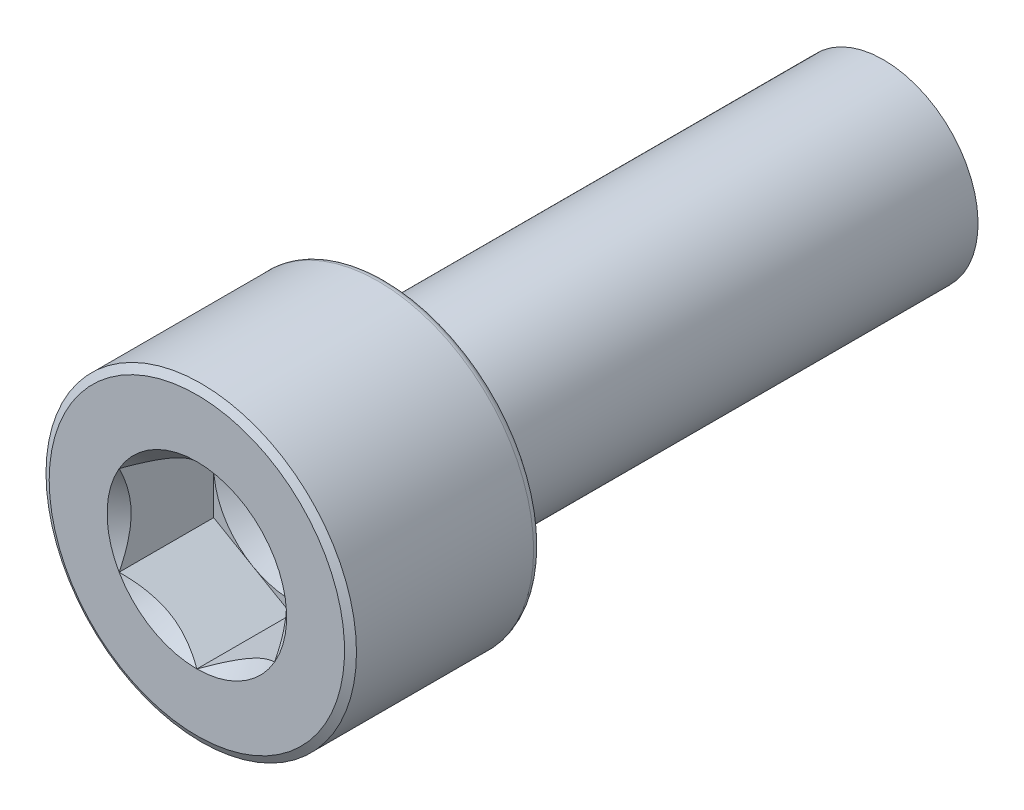
from build123d import *

# Parameters (mm, degrees)
SKETCH1_W          = 12.7
SKETCH1_H          = 2.413
SKETCH4_R          = 3.9624
EXTRUDE1_DEPTH     = 4.826
FILLET1_R          = 0.19304
CHAMFER1_SIZE      = 0.19304
CHAMFER1_SIZE2     = 0.111451696
CUT_EXTRUDE1_DEPTH = 2.413
SKETCH8_R          = 1.984375
CUT_EXTRUDE5_DEPTH = 0.804333333
CUT_EXTRUDE5_DRAFT = -60


with BuildPart() as part:
    # Sketch1 → Revolve1 (revolve)
    with BuildSketch(Plane(origin=(0, 0, 0), x_dir=(0, 0, -1), z_dir=(1, 0, 0))):
        with Locations((6.35, 1.2065)):
            Rectangle(SKETCH1_W, SKETCH1_H)
    revolve(axis=Axis((0, 0, 0), (0, 0, 1)))

    # Sketch4 → Extrude1 (add)
    with BuildSketch(Plane.XY):
        Circle(SKETCH4_R)
    extrude(amount=EXTRUDE1_DEPTH)

    # Fillet1
    fillet1_edges = [part.edges().sort_by_distance(p)[0] for p in [
        (-3.9624, 0, 0),
    ]]
    fillet(fillet1_edges, radius=FILLET1_R)

    # Chamfer1
    chamfer1_edges = [part.edges().sort_by_distance(p)[0] for p in [
        (-3.9624, 0, 4.826),
    ]]
    chamfer1_side = [part.faces().sort_by_distance(p)[0] for p in [
        (0, 0, 4.826),
    ]]
    chamfer(chamfer1_edges, length=CHAMFER1_SIZE, length2=CHAMFER1_SIZE2, reference=chamfer1_side[0])

    # Sketch6 → Cut-Extrude1 (cut)
    with BuildSketch(Plane.XY.offset(4.826)):
        Polygon((0, -2.291358881), (1.984375, -1.14567944), (1.984375, 1.14567944), (0, 2.291358881), (-1.984375, 1.14567944), (-1.984375, -1.14567944), align=None)
    extrude(amount=-CUT_EXTRUDE1_DEPTH, mode=Mode.SUBTRACT)

    # Cut-Extrude4 cone 1 section (through the dimple's axis) → Cut-Extrude4 (revolve, cut)
    with BuildSketch(Plane(origin=(0, 0, 4.826), x_dir=(0, -1, 0), z_dir=(1, 0, 0))):
        Polygon((0, 0), (2.291358881, 0), (0, 2.291358881), align=None)
    revolve(axis=Axis((0, 0, 4.826), (0, 0, -1)), mode=Mode.SUBTRACT)


with BuildPart() as cut_extrude5_tool:
    # Sketch8 → Cut-Extrude5 (with draft: the straight prism first)
    with BuildSketch(Plane.XY.offset(2.413)):
        Circle(SKETCH8_R)
    extrude(amount=-CUT_EXTRUDE5_DEPTH)
    # Cut-Extrude5: the draft: its side faces are tilted about the plane it starts from
    cut_extrude5_sides = [cut_extrude5_tool.faces().sort_by_distance(p)[0] for p in [
        (-1.984375, 0, 2.010833333),
    ]]
    draft(cut_extrude5_sides, Plane.XY.offset(2.413), CUT_EXTRUDE5_DRAFT)


with BuildPart() as part_1:
    add(part.part)

    # Cut-Extrude5: cut by cut_extrude5_tool
    add(cut_extrude5_tool.part, mode=Mode.SUBTRACT)


solid = part_1.part
